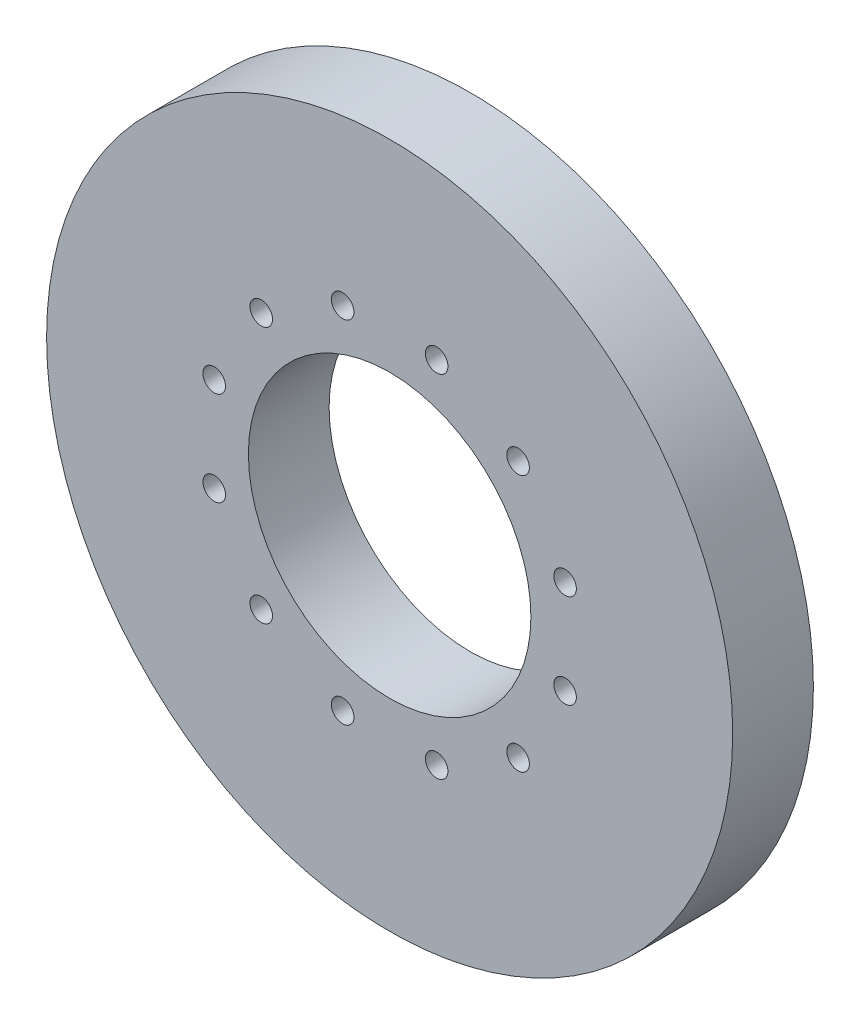
from build123d import *

# Parameters (mm, degrees)
SKETCH1_R           = 42.5
SKETCH1_R_2         = 17.5
BOSS_EXTRUDE1_DEPTH = 10
SKETCH2_R           = 1.4
CUT_EXTRUDE1_DEPTH  = 61.930288035
CIRPATTERN1_COUNT   = 12


with BuildPart() as part:
    # Sketch1 → Boss-Extrude1 (new body)
    with BuildSketch(Plane.XY):
        Circle(SKETCH1_R)
        Circle(SKETCH1_R_2, mode=Mode.SUBTRACT)
    extrude(amount=BOSS_EXTRUDE1_DEPTH)

    # Sketch2 → Cut-Extrude1 (cut, through all)
    with BuildSketch(Plane.XY.offset(10)):
        with Locations((21.733331092, 5.823428515)):
            Circle(SKETCH2_R)
    cut_extrude1 = extrude(amount=-CUT_EXTRUDE1_DEPTH, mode=Mode.SUBTRACT)

    # CirPattern1: Cut-Extrude1 ×12 about axis
    cirpattern1_axis = Axis((0, 0, 0), (0, 0, 1))
    for i in range(1, CIRPATTERN1_COUNT):
        add(cut_extrude1.rotate(cirpattern1_axis, i * 360 / CIRPATTERN1_COUNT), mode=Mode.SUBTRACT)


solid = part.part
